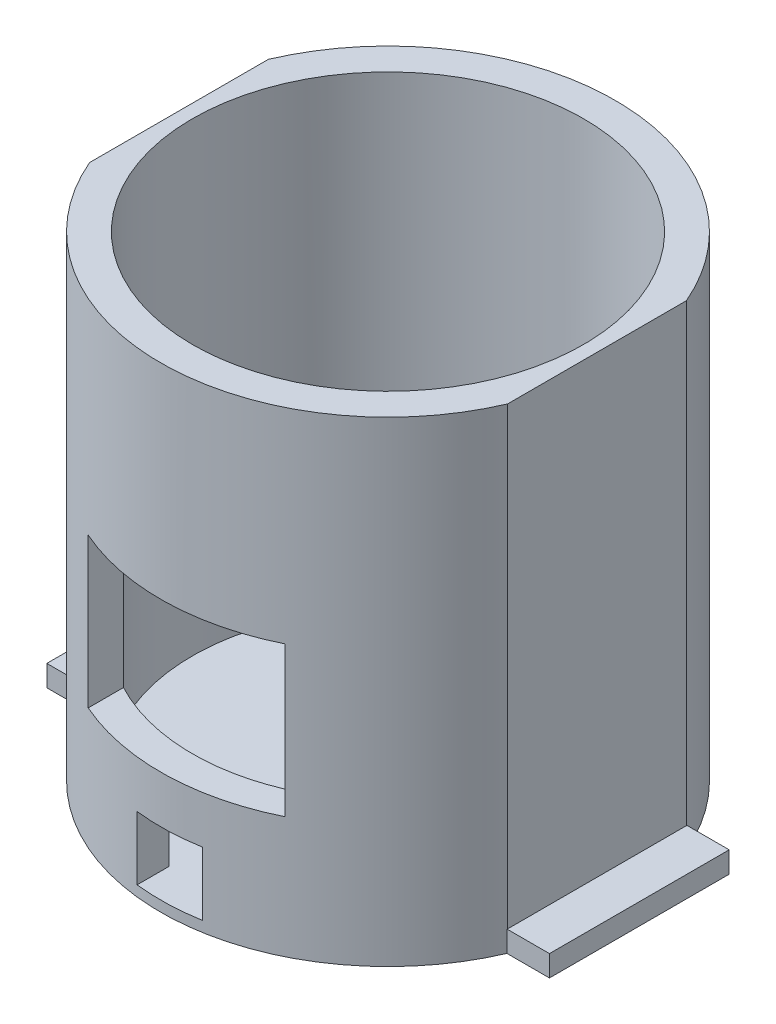
from build123d import *

# Parameters (mm, degrees)
SKETCH1_R               = 18.5
BOSS_EXTRUDE1_DEPTH     = 45
SKETCH1_3_R             = 18.5
BOSS_EXTRUDE2_DEPTH     = 1
CUT_EXTRUDE1_REACH      = 55.648
CUT_EXTRUDE1_END_RADIUS = 21.5
SKETCH2_W               = 6
SKETCH2_H               = 6
SKETCH2_W_2             = 18.211242215
SKETCH2_H_2             = 14.156014421
SKETCH3_W               = 4
SKETCH3_H               = 2
BOSS_EXTRUDE3_DEPTH     = 8.5


with BuildPart() as part:
    # Sketch1 → Boss-Extrude1 (new body)
    with BuildSketch(Plane(origin=(0, 0, 0), x_dir=(1, 0, 0), z_dir=(0, 1, 0))):
        with BuildLine():
            ThreePointArc((19.769048133, 8.451907235), (0, 21.5), (-19.769048133, 8.451907235))
            Line((-19.769048133, 8.451907235), (-19.769048133, -8.451907235))
            ThreePointArc((-19.769048133, -8.451907235), (0, -21.5), (19.769048133, -8.451907235))
            Line((19.769048133, -8.451907235), (19.769048133, 8.451907235))
        make_face()
        Circle(SKETCH1_R, mode=Mode.SUBTRACT)
    extrude(amount=BOSS_EXTRUDE1_DEPTH)

    # Sketch1<3> → Boss-Extrude2 (add)
    with BuildSketch(Plane(origin=(0, 0, 0), x_dir=(1, 0, 0), z_dir=(0, 1, 0))):
        Circle(SKETCH1_3_R)
    extrude(amount=BOSS_EXTRUDE2_DEPTH)

    # Cut-Extrude1: up to this cylinder (the profile starts inside it)
    cut_extrude1_end = Plane(origin=(0, 11.2781055, 0), z_dir=(0, -1, 0)) * Cylinder(CUT_EXTRUDE1_END_RADIUS, 169.852211, mode=Mode.PRIVATE)
    # Sketch2 → Cut-Extrude1 (cut, up to the surface)
    with BuildSketch(Plane.XY, mode=Mode.PRIVATE) as cut_extrude1_sk1:
        with Locations((0.640621421, 4)):
            Rectangle(SKETCH2_W, SKETCH2_H)
    cut_extrude1_tool1 = extrude(cut_extrude1_sk1.sketch, amount=CUT_EXTRUDE1_REACH, mode=Mode.PRIVATE) & cut_extrude1_end
    add(cut_extrude1_tool1.solids().sort_by_distance((0.640621, 4, 0))[0], mode=Mode.SUBTRACT)
    # Sketch2 → Cut-Extrude1 (cut, up to the surface)
    with BuildSketch(Plane.XY, mode=Mode.PRIVATE) as cut_extrude1_sk2:
        with Locations((0.419944281, 18.556211079)):
            Rectangle(SKETCH2_W_2, SKETCH2_H_2)
    cut_extrude1_tool2 = extrude(cut_extrude1_sk2.sketch, amount=CUT_EXTRUDE1_REACH, mode=Mode.PRIVATE) & cut_extrude1_end
    add(cut_extrude1_tool2.solids().sort_by_distance((0.419944, 18.556211, 0))[0], mode=Mode.SUBTRACT)

    # Sketch3 → Boss-Extrude3 (add, symmetric)
    with BuildSketch(Plane.XY):
        with Locations((-21.769048133, 1)):
            Rectangle(SKETCH3_W, SKETCH3_H)
    boss_extrude3 = extrude(amount=BOSS_EXTRUDE3_DEPTH, both=True)

    # Mirror1: Boss-Extrude3 across plane
    add(boss_extrude3.mirror(Plane(origin=(0, 0, 0), x_dir=(0, 0, 1), z_dir=(1, 0, 0))))


solid = part.part
